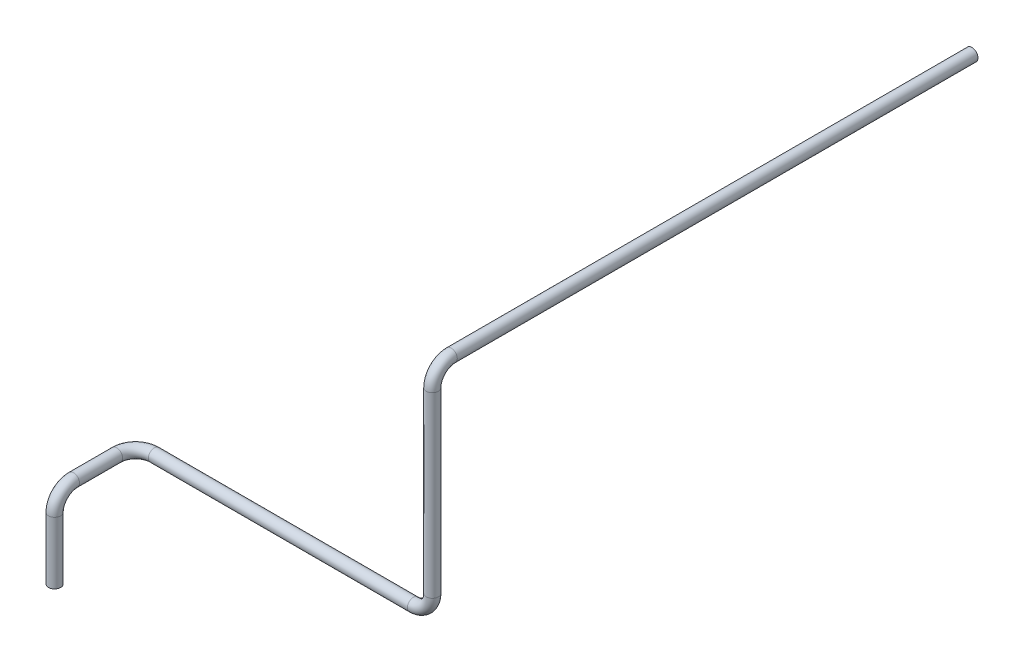
from build123d import *

# Parameters (mm, degrees)
CROQUIS1_R              = 22.5
SALIENTE_EXTRUIR1_DEPTH = 100
CROQUIS3_R              = 22.5


with BuildPart() as part:
    # Croquis1 → Saliente-Extruir1 (new body)
    with BuildSketch(Plane.XY):
        Circle(CROQUIS1_R)
    extrude(amount=SALIENTE_EXTRUIR1_DEPTH)

    # Barrer1: sweep along a curve in space
    with BuildLine() as barrer1_path:
        Line((0, 0, 100), (0, 0, 1930))
        ThreePointArc((0, 0, 1930), (0, -20.502525317, 1979.497474683), (0, -70, 2000))
        Line((0, -70, 2000), (0, -730, 2000))
        ThreePointArc((0, -730, 2000), (-20.502525317, -779.497474683, 2000), (-70, -800, 2000))
        Line((-70, -800, 2000), (-1030, -800, 2000))
        ThreePointArc((-1030, -800, 2000), (-1079.497474683, -800, 2020.502525317), (-1100, -800, 2070))
        Line((-1100, -800, 2070), (-1100, -800, 2230))
        ThreePointArc((-1100, -800, 2230), (-1100, -820.502525317, 2279.497474683), (-1100, -870, 2300))
        Line((-1100, -870, 2300), (-1100, -1100, 2300))
    # Croquis3 → Barrer1 (sweep)
    with BuildSketch(Plane.XY.offset(100)):
        Circle(CROQUIS3_R)
    sweep(path=barrer1_path.line)


solid = part.part
